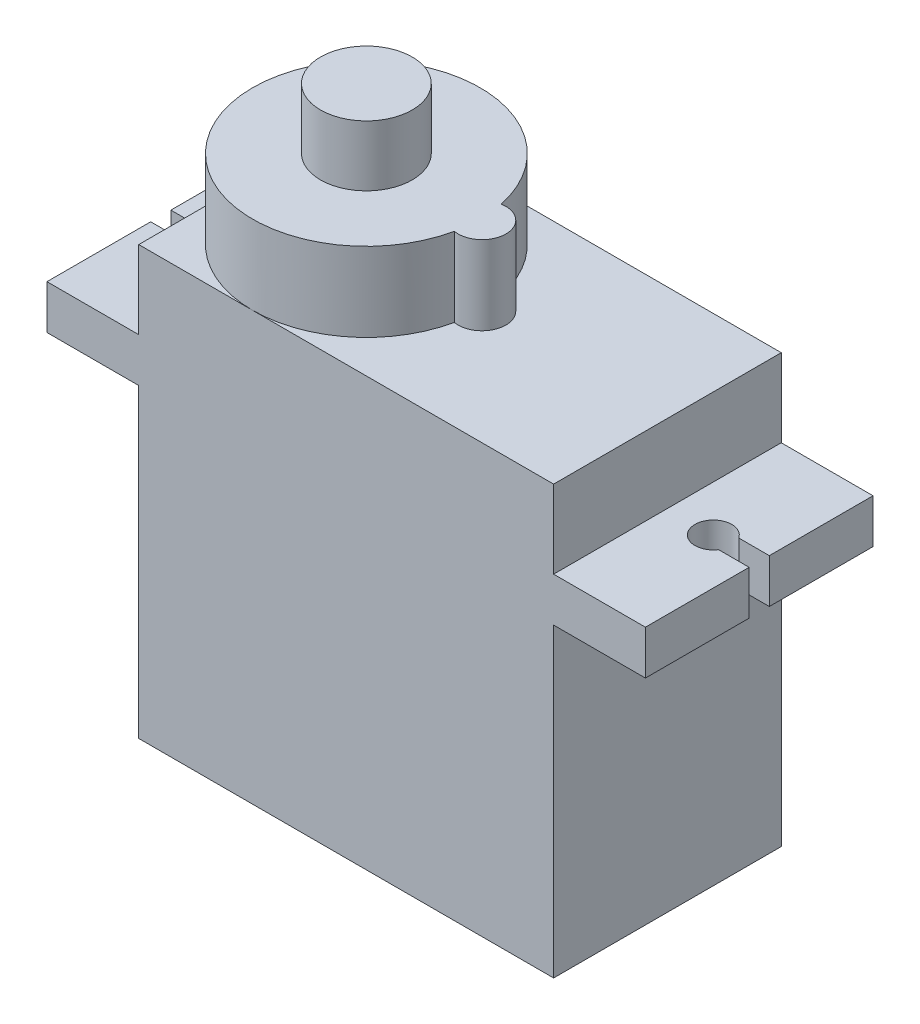
from build123d import *

# Parameters (mm, degrees)
SKETCH1_W             = 22.6
SKETCH1_H             = 12.4
BOSS_EXTRUDE1_DEPTH   = 23.3
SKETCH2_W             = 12.4
SKETCH2_H             = 2.4
BOSS_EXTRUDE2_DEPTH   = 5
SKETCH3_W             = 12.4
SKETCH3_H             = 2.4
BOSS_EXTRUDE3_DEPTH   = 5
CUT_EXTRUDE1_REACH    = 27.827
BOSS_EXTRUDE4_DEPTH   = 4.3
SKETCH7_R             = 2.5
BOSS_EXTRUDE5_DEPTH   = 3.3
SKETCH8_R             = 0.6
BOSS_EXTRUDE7_DEPTH   = 2.3
BOSS_EXTRUDE7_2_DEPTH = 2.3
BOSS_EXTRUDE7_3_DEPTH = 2.3


with BuildPart() as part:
    # Sketch1 → Boss-Extrude1 (new body)
    with BuildSketch(Plane(origin=(0, 0, 0), x_dir=(1, 0, 0), z_dir=(0, 1, 0))):
        Rectangle(SKETCH1_W, SKETCH1_H)
    extrude(amount=BOSS_EXTRUDE1_DEPTH)

    # Sketch2 → Boss-Extrude2 (add)
    with BuildSketch(Plane(origin=(11.3, 0, 0), x_dir=(0, 0, -1), z_dir=(1, 0, 0))):
        with Locations((0, 17.85)):
            Rectangle(SKETCH2_W, SKETCH2_H)
    extrude(amount=BOSS_EXTRUDE2_DEPTH)

    # Sketch3 → Boss-Extrude3 (add)
    with BuildSketch(Plane.ZY.offset(11.3)):
        with Locations((0, 17.85)):
            Rectangle(SKETCH3_W, SKETCH3_H)
    extrude(amount=BOSS_EXTRUDE3_DEPTH)

    # Sketch4 → Cut-Extrude1 (cut, up to next)
    with BuildSketch(Plane(origin=(0, 19.05, 0), x_dir=(1, 0, 0), z_dir=(0, 1, 0)), mode=Mode.PRIVATE) as cut_extrude1_sk1:
        with BuildLine():
            Line((-16.3, 0.55), (-14.635164654, 0.55))
            ThreePointArc((-14.635164654, 0.55), (-12.8, 0), (-14.635164654, -0.55))
            Line((-14.635164654, -0.55), (-16.3, -0.55))
            Line((-16.3, -0.55), (-16.3, 0.55))
        make_face()
    cut_extrude1_tool1 = extrude(cut_extrude1_sk1.sketch, amount=-CUT_EXTRUDE1_REACH, mode=Mode.PRIVATE) & part.part
    # Sketch4 → Cut-Extrude1 (cut, up to next)
    with BuildSketch(Plane(origin=(0, 19.05, 0), x_dir=(1, 0, 0), z_dir=(0, 1, 0)), mode=Mode.PRIVATE) as cut_extrude1_sk2:
        with BuildLine():
            Line((16.3, -0.55), (14.635164654, -0.55))
            ThreePointArc((14.635164654, -0.55), (12.8, 0), (14.635164654, 0.55))
            Line((14.635164654, 0.55), (16.3, 0.55))
            Line((16.3, 0.55), (16.3, -0.55))
        make_face()
    cut_extrude1_tool2 = extrude(cut_extrude1_sk2.sketch, amount=-CUT_EXTRUDE1_REACH, mode=Mode.PRIVATE) & part.part
    add(cut_extrude1_tool1.solids().sort_by_distance((-14.40681, 19.05, 0))[0], mode=Mode.SUBTRACT)
    add(cut_extrude1_tool2.solids().sort_by_distance((14.40681, 19.05, 0))[0], mode=Mode.SUBTRACT)

    # Sketch6 → Boss-Extrude4 (add)
    with BuildSketch(Plane(origin=(0, 23.3, 0), x_dir=(1, 0, 0), z_dir=(0, 1, 0))):
        with BuildLine():
            ThreePointArc((1.2, -1.3), (2.5, 0), (1.2, 1.3))
            ThreePointArc((1.2, 1.3), (1.082856772, 1.294711344), (0.966666667, 1.278888406))
            ThreePointArc((0.966666667, 1.278888406), (0.964431433, 1.289446156), (0.962177826, 1.3))
            ThreePointArc((0.962177826, 1.3), (-11.3, 0), (0.962177826, -1.3))
            ThreePointArc((0.962177826, -1.3), (0.964431433, -1.289446156), (0.966666667, -1.278888406))
            ThreePointArc((0.966666667, -1.278888406), (1.082856772, -1.294711344), (1.2, -1.3))
        make_face()
    extrude(amount=BOSS_EXTRUDE4_DEPTH)

    # Sketch7 → Boss-Extrude5 (add)
    with BuildSketch(Plane(origin=(0, 27.6, 0), x_dir=(1, 0, 0), z_dir=(0, 1, 0))):
        with Locations((-5.1, 0)):
            Circle(SKETCH7_R)
    extrude(amount=BOSS_EXTRUDE5_DEPTH)


with BuildPart() as body_2:
    # Sketch8 → Boss-Extrude7 (new body)
    with BuildSketch(Plane.ZY.offset(11.3)):
        with Locations((-1.2, 4.5)):
            Circle(SKETCH8_R)
    extrude(amount=BOSS_EXTRUDE7_DEPTH)


with BuildPart() as body_3:
    # Sketch8 → Boss-Extrude7 2 (new body)
    with BuildSketch(Plane.ZY.offset(11.3)):
        with Locations((1.2, 4.5)):
            Circle(SKETCH8_R)
    extrude(amount=BOSS_EXTRUDE7_2_DEPTH)


with BuildPart() as body_4:
    # Sketch8 → Boss-Extrude7 3 (new body)
    with BuildSketch(Plane.ZY.offset(11.3)):
        with BuildLine():
            ThreePointArc((0.6, 4.5), (0, 5.1), (-0.6, 4.5))
            ThreePointArc((-0.6, 4.5), (0, 3.9), (0.6, 4.5))
        make_face()
    extrude(amount=BOSS_EXTRUDE7_3_DEPTH)


solid = Compound([part.part, body_2.part, body_3.part, body_4.part])
